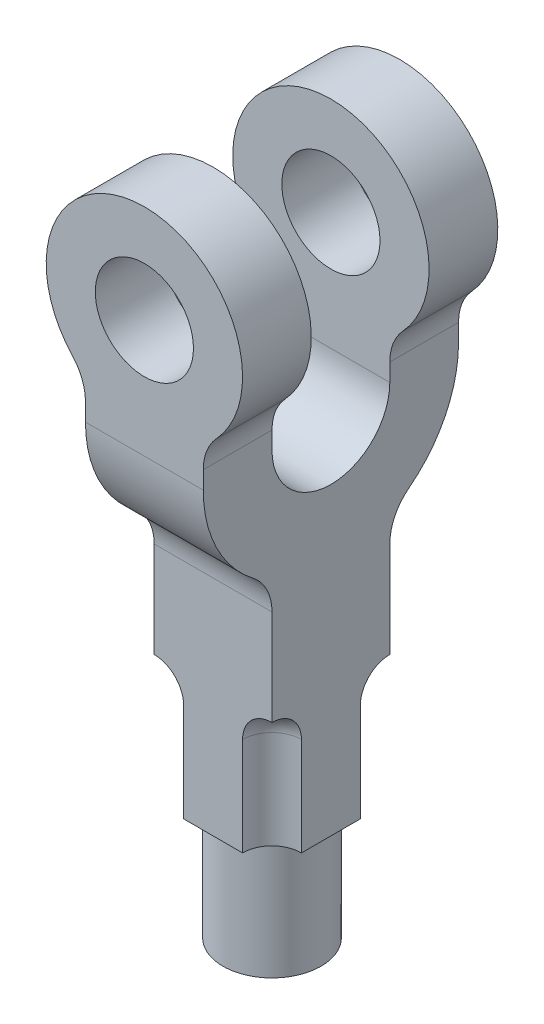
from build123d import *

# Parameters (mm, degrees)
BOSS_EXTRUDE1_DEPTH = 24
SKETCH2_R           = 10
BOSS_EXTRUDE2_DEPTH = 24
CIRPATTERN1_COUNT   = 4
BOSS_EXTRUDE4_START = -38
BOSS_EXTRUDE4_DEPTH = 14
BOSS_EXTRUDE5_DEPTH = 14
CUT_EXTRUDE1_DEPTH  = 102.434708064
FILLET1_R           = 10
FILLET2_R           = 10


with BuildPart() as part:
    # Sketch1 → Boss-Extrude1 (new body)
    with BuildSketch(Plane.YZ):
        with BuildLine():
            Line((81, 12), (81, 26))
            Line((81, 26), (37, 26))
            ThreePointArc((37, 26), (23.509262437, 22.226110771), (13.934874811, 12))
            Line((13.934874811, 12), (-37, 12))
            Line((-37, 12), (-37, -12))
            Line((-37, -12), (13.934874811, -12))
            ThreePointArc((13.934874811, -12), (23.509262437, -22.226110771), (37, -26))
            Line((37, -26), (81, -26))
            Line((81, -26), (81, -12))
            Line((81, -12), (37, -12))
            ThreePointArc((37, -12), (25, 0), (37, 12))
            Line((37, 12), (81, 12))
        make_face()
    extrude(amount=BOSS_EXTRUDE1_DEPTH)

    # Sketch2 → Boss-Extrude2 (add)
    with BuildSketch(Plane.XZ.offset(37)):
        with Locations(Location((12, 0, 0), (0, 0, 270))):
            Circle(SKETCH2_R)
    extrude(amount=BOSS_EXTRUDE2_DEPTH)

    # Sketch3 → Cut-Revolve2 (revolve, cut)
    with BuildSketch(Plane.YZ.offset(24)):
        with BuildLine():
            Line((-37, 12), (-37, 6))
            Line((-37, 6), (-17, 6))
            ThreePointArc((-17, 6), (-12.757359313, 7.757359313), (-11, 12))
            Line((-11, 12), (-37, 12))
        make_face()
    cut_revolve2 = revolve(axis=Axis((24, 13.934874811, 12), (0, 1, 0)), mode=Mode.SUBTRACT)

    # CirPattern1: Cut-Revolve2 ×4 about axis
    cirpattern1_axis = Axis((12, 0, 0), (0, 1, 0))
    for i in range(1, CIRPATTERN1_COUNT):
        add(cut_revolve2.rotate(cirpattern1_axis, i * 360 / CIRPATTERN1_COUNT), mode=Mode.SUBTRACT)

    # Sketch4 → Boss-Extrude4 (add, through all)
    with BuildSketch(Plane.XY.offset(26).offset(BOSS_EXTRUDE4_START)):
        with BuildLine():
            Line((24, 61), (24, 45))
            ThreePointArc((24, 45), (29.88854382, 52.05572809), (32, 61))
            ThreePointArc((32, 61), (29.88854382, 69.94427191), (24, 77))
            Line((24, 77), (24, 61))
        make_face()
        with BuildLine():
            Line((0, 45), (0, 61))
            Line((0, 61), (0, 77))
            ThreePointArc((0, 77), (-8, 61), (0, 45))
        make_face()
    extrude(amount=-BOSS_EXTRUDE4_DEPTH)

    # Sketch4<3> → Boss-Extrude5 (add)
    with BuildSketch(Plane.XY.offset(26)):
        with BuildLine():
            Line((24, 61), (24, 45))
            ThreePointArc((24, 45), (29.88854382, 52.05572809), (32, 61))
            ThreePointArc((32, 61), (29.88854382, 69.94427191), (24, 77))
            Line((24, 77), (24, 61))
        make_face()
        with BuildLine():
            Line((0, 45), (0, 61))
            Line((0, 61), (0, 77))
            ThreePointArc((0, 77), (-8, 61), (0, 45))
        make_face()
    extrude(amount=-BOSS_EXTRUDE5_DEPTH)

    # Sketch4<4> → Cut-Extrude1 (cut, through all)
    with BuildSketch(Plane.XY.offset(26)):
        with BuildLine():
            Line((24, 81), (12, 81))
            ThreePointArc((12, 81), (18.32455532, 79.973665961), (24, 77))
            Line((24, 77), (24, 81))
        make_face()
        with BuildLine():
            Line((0, 81), (0, 77))
            ThreePointArc((0, 77), (5.67544468, 79.973665961), (12, 81))
            Line((12, 81), (0, 81))
        make_face()
        with BuildLine():
            ThreePointArc((22, 61), (12, 71), (2, 61))
            Line((2, 61), (12, 61))
            Line((12, 61), (22, 61))
        make_face()
        with BuildLine():
            Line((12, 61), (2, 61))
            ThreePointArc((2, 61), (12, 51), (22, 61))
            Line((22, 61), (12, 61))
        make_face()
    extrude(amount=-CUT_EXTRUDE1_DEPTH, mode=Mode.SUBTRACT)

    # Fillet1
    fillet1_edges = [part.edges().sort_by_distance(p)[0] for p in [
        (24, 45, -19),
        (0, 45, -19),
        (24, 45, 19),
        (0, 45, 19),
    ]]
    fillet(fillet1_edges, radius=FILLET1_R)

    # Fillet2
    fillet2_edges = [part.edges().sort_by_distance(p)[0] for p in [
        (12, 13.934874811, -12),
        (12, 13.934874811, 12),
    ]]
    fillet(fillet2_edges, radius=FILLET2_R)


solid = part.part
